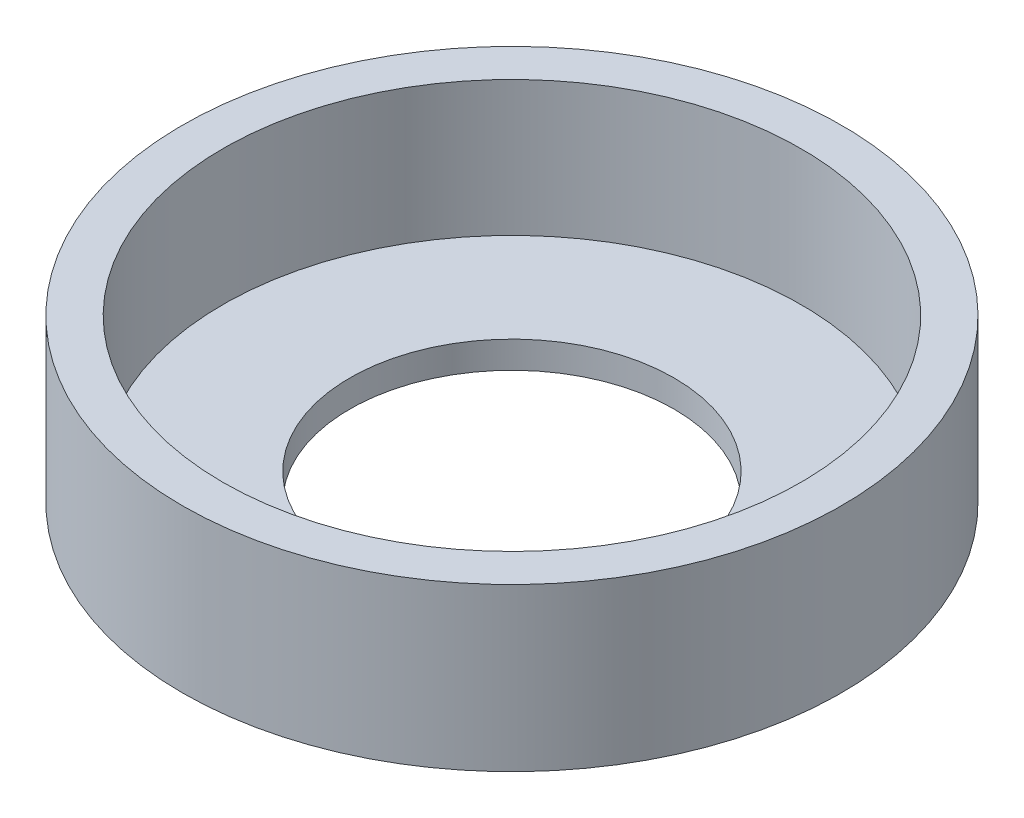
from build123d import *


with BuildPart() as part:
    # Sketch1 → Revolve1 (revolve)
    with BuildSketch(Plane(origin=(0, 0, 0), x_dir=(0, 0, -1), z_dir=(1, 0, 0))):
        Polygon((-12.2, 3), (-12.2, -3), (-6, -3), (-6, -2), (-10.7, -2), (-10.7, 3), align=None)
    revolve(axis=Axis((0, 27.077205882, 0), (0, -1, 0)))


solid = part.part
